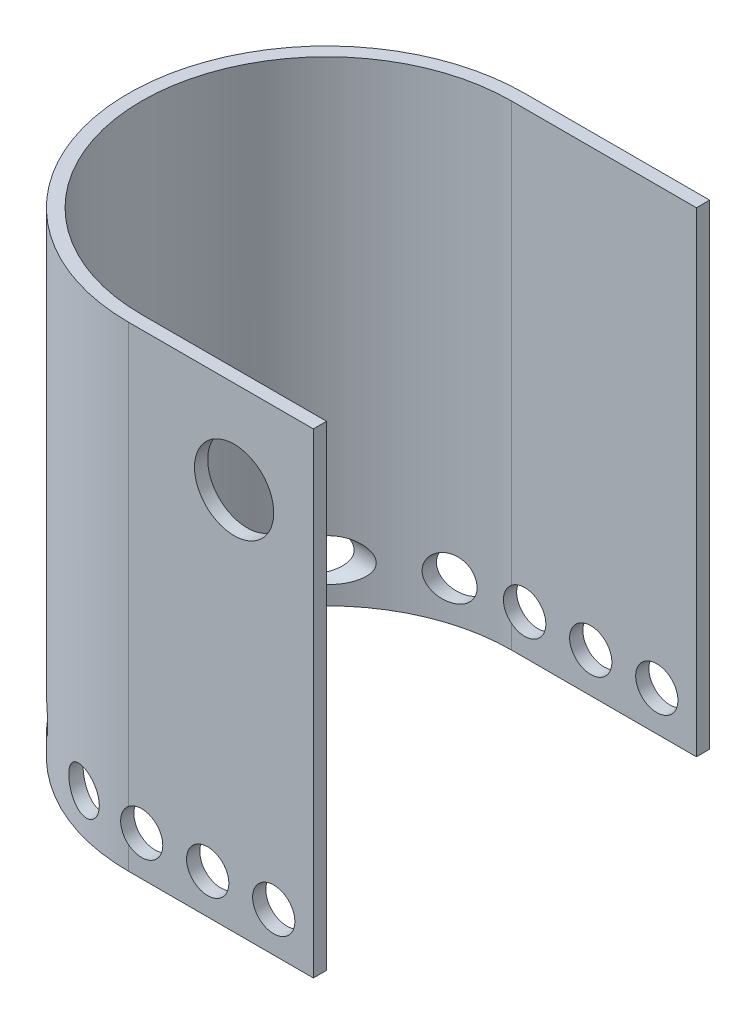
from build123d import *

# Parameters (mm, degrees)
BOSS_EXTRUDE1_DEPTH = 18
SKETCH2_R           = 1.5
CUT_EXTRUDE1_DEPTH  = 2
SKETCH3_R           = 0.8
CUT_EXTRUDE2_DEPTH  = 25.6018292
SKETCH4_R           = 0.8
CUT_EXTRUDE3_DEPTH  = 21.892582574


with BuildPart() as part:
    # Sketch1 → Boss-Extrude1 (new body)
    with BuildSketch(Plane(origin=(0, 0, 0), x_dir=(1, 0, 0), z_dir=(0, 1, 0))):
        with BuildLine():
            Line((0, 7.5), (7, 7.5))
            Line((7, 7.5), (7, 7))
            Line((7, 7), (0, 7))
            ThreePointArc((0, 7), (-7, 0), (0, -7))
            Line((0, -7), (7, -7))
            Line((7, -7), (7, -7.5))
            Line((7, -7.5), (0, -7.5))
            ThreePointArc((0, -7.5), (-7.5, 0), (0, 7.5))
        make_face()
    extrude(amount=BOSS_EXTRUDE1_DEPTH)

    # Sketch2 → Cut-Extrude1 (cut)
    with BuildSketch(Plane(origin=(0, 0, 7.5), x_dir=(-1, 0, 0), z_dir=(0, 0, -1))):
        with Locations(Location((-4, 14.5, 0), (0, 0, 180))):
            Circle(SKETCH2_R)
    extrude(amount=CUT_EXTRUDE1_DEPTH, mode=Mode.SUBTRACT)

    # Sketch3 → Cut-Extrude2 (cut, through all)
    with BuildSketch(Plane(origin=(0, 0, -7.5), x_dir=(-1, 0, 0), z_dir=(0, 0, -1))):
        with Locations((-5.5, 1.5)):
            Circle(SKETCH3_R)
        with Locations((-3, 1.5)):
            Circle(SKETCH3_R)
        with Locations(Location((-0.5, 1.5, 0), (0, 0, 51.317812547))):
            Circle(SKETCH3_R)
        with Locations((2, 1.5)):
            Circle(SKETCH3_R)
    extrude(amount=-CUT_EXTRUDE2_DEPTH, mode=Mode.SUBTRACT)

    # Sketch4 → Cut-Extrude3 (cut, through all)
    with BuildSketch(Plane(origin=(0, 0, 0), x_dir=(0, 0, -1), z_dir=(1, 0, 0))):
        with Locations((0, 1.5)):
            Circle(SKETCH4_R)
        with Locations((2.5, 1.5)):
            Circle(SKETCH4_R)
        with Locations((5, 1.5)):
            Circle(SKETCH4_R)
        with Locations((-2.5, 1.5)):
            Circle(SKETCH4_R)
        with Locations((-5, 1.5)):
            Circle(SKETCH4_R)
    extrude(amount=-CUT_EXTRUDE3_DEPTH, mode=Mode.SUBTRACT)


solid = part.part
